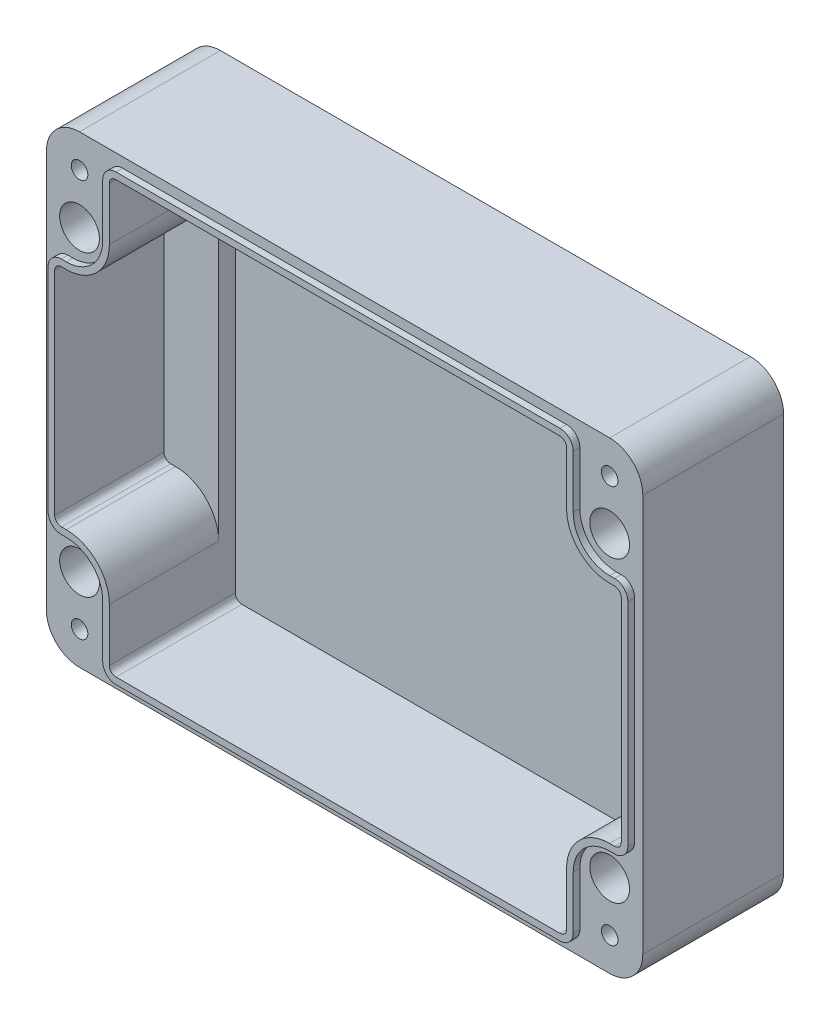
from build123d import *

# Parameters (mm, degrees)
SKETCH1_W                   = 180
SKETCH1_H                   = 140
BOSS_EXTRUDE1_DEPTH         = 42.5
CUT_EXTRUDE1_DEPTH          = 36
FILLET1_R                   = 2
FILLET2_R                   = 13
FILLET3_R                   = 10
BOSS_EXTRUDE2_DEPTH         = 2
F_6_5_6_5_DIAMETER_HOLE1_D  = 6.5
M5_TAPPED_HOLE1_D           = 4.2
M5_TAPPED_HOLE1_DEPTH       = 14
M5_TAPPED_HOLE1_CBORE_D     = 5
M5_TAPPED_HOLE1_CBORE_DEPTH = 10
M5_TAPPED_HOLE1_TIP         = 1.2618073
BOSS_EXTRUDE3_DEPTH         = 5
SKETCH18_R                  = 6
CUT_EXTRUDE4_DEPTH          = 32.5


with BuildPart() as part:
    # Sketch1 → Boss-Extrude1 (new body)
    with BuildSketch(Plane.XY):
        Rectangle(SKETCH1_W, SKETCH1_H)
    extrude(amount=BOSS_EXTRUDE1_DEPTH)

    # Sketch2 → Cut-Extrude1 (cut)
    with BuildSketch(Plane.XY.offset(42.5)):
        Polygon((-69, 65), (69, 65), (69, 34), (85.5, 34), (85.5, -34), (69, -34), (69, -65), (-69, -65), (-69, -34), (-85.5, -34), (-85.5, 34), (-69, 34), align=None)
    extrude(amount=-CUT_EXTRUDE1_DEPTH, mode=Mode.SUBTRACT)

    # Fillet1
    fillet1_edges = [part.edges().sort_by_distance(p)[0] for p in [
        (-69, 65, 24.5),
        (69, 65, 24.5),
        (85.5, 34, 24.5),
        (85.5, -34, 24.5),
        (69, -65, 24.5),
        (-69, -65, 24.5),
        (-85.5, -34, 24.5),
        (-85.5, 34, 24.5),
    ]]
    fillet(fillet1_edges, radius=FILLET1_R)

    # Fillet2
    fillet2_edges = [part.edges().sort_by_distance(p)[0] for p in [
        (-69, 34, 24.5),
        (69, 34, 24.5),
        (69, -34, 24.5),
        (-69, -34, 24.5),
    ]]
    fillet(fillet2_edges, radius=FILLET2_R)

    # Fillet3
    fillet3_edges = [part.edges().sort_by_distance(p)[0] for p in [
        (-90, 70, 21.25),
        (90, 70, 21.25),
        (90, -70, 21.25),
        (-90, -70, 21.25),
    ]]
    fillet(fillet3_edges, radius=FILLET3_R)

    # Sketch3 → Boss-Extrude2 (add)
    with BuildSketch(Plane.XY.offset(42.5)):
        with BuildLine():
            Line((-71, 63), (-71, 47))
            ThreePointArc((-71, 47), (-74.221825407, 39.221825407), (-82, 36))
            Line((-82, 36), (-83.5, 36))
            ThreePointArc((-83.5, 36), (-86.328427125, 34.828427125), (-87.5, 32))
            Line((-87.5, 32), (-87.5, -32))
            ThreePointArc((-87.5, -32), (-86.328427125, -34.828427125), (-83.5, -36))
            Line((-83.5, -36), (-82, -36))
            ThreePointArc((-82, -36), (-74.221825407, -39.221825407), (-71, -47))
            Line((-71, -47), (-71, -63))
            ThreePointArc((-71, -63), (-69.828427125, -65.828427125), (-67, -67))
            Line((-67, -67), (67, -67))
            ThreePointArc((67, -67), (69.828427125, -65.828427125), (71, -63))
            Line((71, -63), (71, -47))
            ThreePointArc((71, -47), (74.221825407, -39.221825407), (82, -36))
            Line((82, -36), (83.5, -36))
            ThreePointArc((83.5, -36), (86.328427125, -34.828427125), (87.5, -32))
            Line((87.5, -32), (87.5, 32))
            ThreePointArc((87.5, 32), (86.328427125, 34.828427125), (83.5, 36))
            Line((83.5, 36), (82, 36))
            ThreePointArc((82, 36), (74.221825407, 39.221825407), (71, 47))
            Line((71, 47), (71, 63))
            ThreePointArc((71, 63), (69.828427125, 65.828427125), (67, 67))
            Line((67, 67), (-67, 67))
            ThreePointArc((-67, 67), (-69.828427125, 65.828427125), (-71, 63))
        make_face()
        with BuildLine():
            Line((-83.5, -34), (-82, -34))
            ThreePointArc((-82, -34), (-72.807611845, -37.807611845), (-69, -47))
            Line((-69, -47), (-69, -63))
            ThreePointArc((-69, -63), (-68.414213562, -64.414213562), (-67, -65))
            Line((-67, -65), (67, -65))
            ThreePointArc((67, -65), (68.414213562, -64.414213562), (69, -63))
            Line((69, -63), (69, -47))
            ThreePointArc((69, -47), (72.807611845, -37.807611845), (82, -34))
            Line((82, -34), (83.5, -34))
            ThreePointArc((83.5, -34), (84.914213562, -33.414213562), (85.5, -32))
            Line((85.5, -32), (85.5, 32))
            ThreePointArc((85.5, 32), (84.914213562, 33.414213562), (83.5, 34))
            Line((83.5, 34), (82, 34))
            ThreePointArc((82, 34), (72.807611845, 37.807611845), (69, 47))
            Line((69, 47), (69, 63))
            ThreePointArc((69, 63), (68.414213562, 64.414213562), (67, 65))
            Line((67, 65), (-67, 65))
            ThreePointArc((-67, 65), (-68.414213562, 64.414213562), (-69, 63))
            Line((-69, 63), (-69, 47))
            ThreePointArc((-69, 47), (-72.807611845, 37.807611845), (-82, 34))
            Line((-82, 34), (-83.5, 34))
            ThreePointArc((-83.5, 34), (-84.914213562, 33.414213562), (-85.5, 32))
            Line((-85.5, 32), (-85.5, -32))
            ThreePointArc((-85.5, -32), (-84.914213562, -33.414213562), (-83.5, -34))
        make_face(mode=Mode.SUBTRACT)
    extrude(amount=BOSS_EXTRUDE2_DEPTH)

    # Ø6.5 (6.5) Diameter Hole1 (through all)
    with Locations(Plane.XY.offset(42.5)):
        with Locations((-80, 45), (-80, -45), (80, -45), (80, 45)):
            Hole(F_6_5_6_5_DIAMETER_HOLE1_D / 2)

    # M5 Tapped Hole1
    with Locations(Plane.XY.offset(42.5)):
        with Locations((-80, 60), (-80, -60), (80, -60), (80, 60)):
            CounterBoreHole(M5_TAPPED_HOLE1_D / 2, M5_TAPPED_HOLE1_CBORE_D / 2, M5_TAPPED_HOLE1_CBORE_DEPTH, depth=M5_TAPPED_HOLE1_DEPTH)
            with Locations((0, 0, -(M5_TAPPED_HOLE1_DEPTH + M5_TAPPED_HOLE1_TIP / 2))):  # 118° drill point
                Cone(0, M5_TAPPED_HOLE1_D / 2, M5_TAPPED_HOLE1_TIP, mode=Mode.SUBTRACT)

    # Sketch13 → Boss-Extrude3 (add)
    with BuildSketch(Plane.XY.offset(6.5)):
        with BuildLine():
            Line((-69, 47), (-69, -47))
            ThreePointArc((-69, -47), (-72.807611845, -37.807611845), (-82, -34))
            Line((-82, -34), (-83.5, -34))
            ThreePointArc((-83.5, -34), (-84.914213562, -33.414213562), (-85.5, -32))
            Line((-85.5, -32), (-85.5, 32))
            ThreePointArc((-85.5, 32), (-84.914213562, 33.414213562), (-83.5, 34))
            Line((-83.5, 34), (-82, 34))
            ThreePointArc((-82, 34), (-72.807611845, 37.807611845), (-69, 47))
        make_face()
        with BuildLine():
            Line((69, 47), (69, -47))
            ThreePointArc((69, -47), (72.807611845, -37.807611845), (82, -34))
            Line((82, -34), (83.5, -34))
            ThreePointArc((83.5, -34), (84.914213562, -33.414213562), (85.5, -32))
            Line((85.5, -32), (85.5, 32))
            ThreePointArc((85.5, 32), (84.914213562, 33.414213562), (83.5, 34))
            Line((83.5, 34), (82, 34))
            ThreePointArc((82, 34), (72.807611845, 37.807611845), (69, 47))
        make_face()
    extrude(amount=BOSS_EXTRUDE3_DEPTH)

    # Sketch18 → Cut-Extrude4 (cut)
    with BuildSketch(Plane.XY.offset(42.5)):
        with Locations((-80, 45)):
            Circle(SKETCH18_R)
        with Locations((-80, -45)):
            Circle(SKETCH18_R)
        with Locations((80, -45)):
            Circle(SKETCH18_R)
        with Locations((80, 45)):
            Circle(SKETCH18_R)
    extrude(amount=-CUT_EXTRUDE4_DEPTH, mode=Mode.SUBTRACT)


solid = part.part
